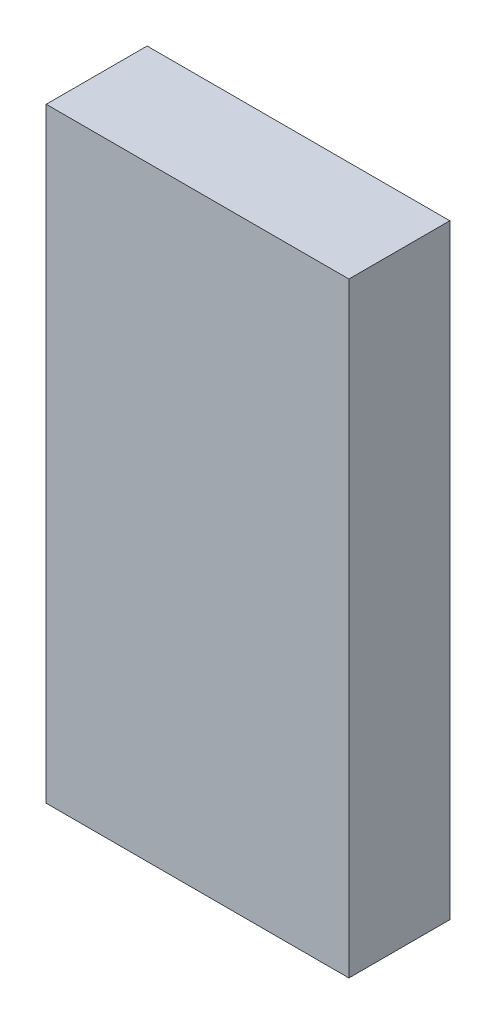
from build123d import *

# Parameters (mm, degrees)
SKETCH1_W           = 6
SKETCH1_H           = 12
BOSS_EXTRUDE1_DEPTH = 2


with BuildPart() as part:
    # Sketch1 → Boss-Extrude1 (new body)
    with BuildSketch(Plane.XY):
        Rectangle(SKETCH1_W, SKETCH1_H)
    extrude(amount=BOSS_EXTRUDE1_DEPTH)


solid = part.part
